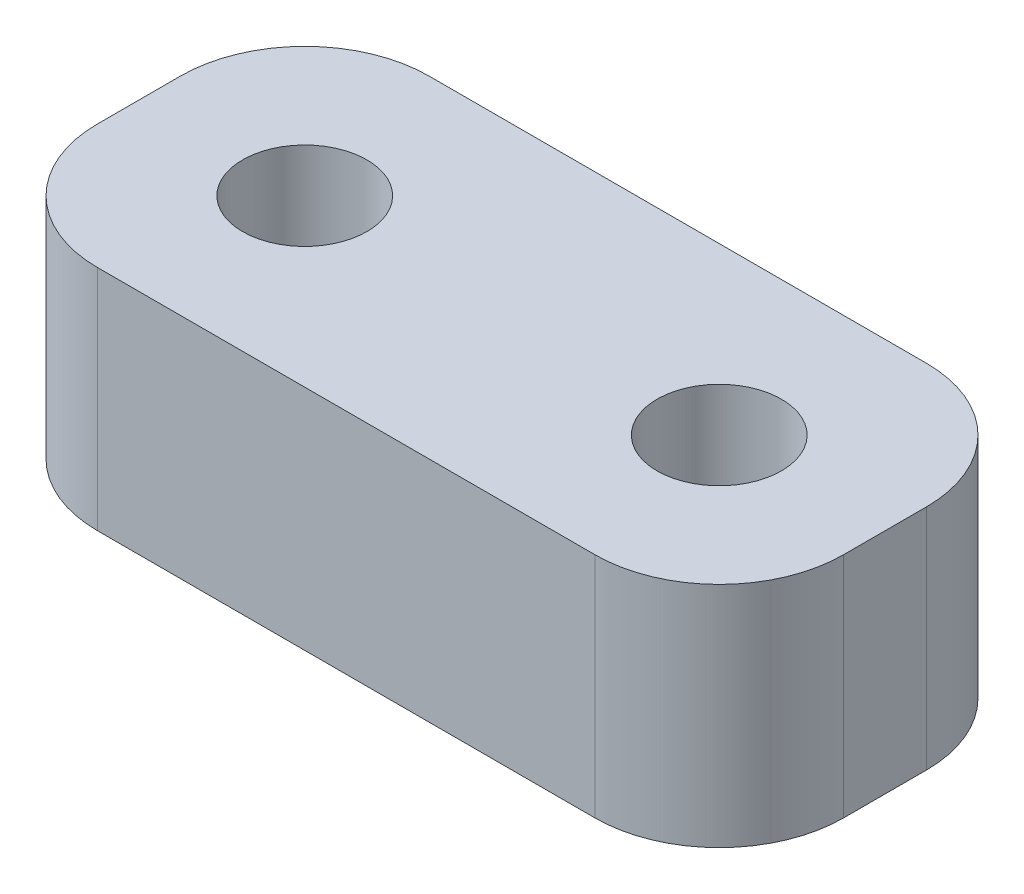
from build123d import *

# Parameters (mm, degrees)
SKETCH1_W           = 18
SKETCH1_H           = 8
SKETCH1_R           = 1.5
BOSS_EXTRUDE1_DEPTH = 5.5
FILLET1_R           = 3


with BuildPart() as part:
    # Sketch1 → Boss-Extrude1 (new body)
    with BuildSketch(Plane(origin=(0, 0, 0), x_dir=(1, 0, 0), z_dir=(0, 1, 0))):
        with Locations((9, 4)):
            Rectangle(SKETCH1_W, SKETCH1_H)
        with Locations(Location((4, 4, 0), (0, 0, 270))):
            Circle(SKETCH1_R, mode=Mode.SUBTRACT)
        with Locations(Location((14, 4, 0), (0, 0, 270))):
            Circle(SKETCH1_R, mode=Mode.SUBTRACT)
    extrude(amount=BOSS_EXTRUDE1_DEPTH)

    # Fillet1
    fillet1_edges = [part.edges().sort_by_distance(p)[0] for p in [
        (0, 2.75, -8),
        (18, 2.75, -8),
        (18, 2.75, 0),
        (0, 2.75, 0),
    ]]
    fillet(fillet1_edges, radius=FILLET1_R)


solid = part.part
